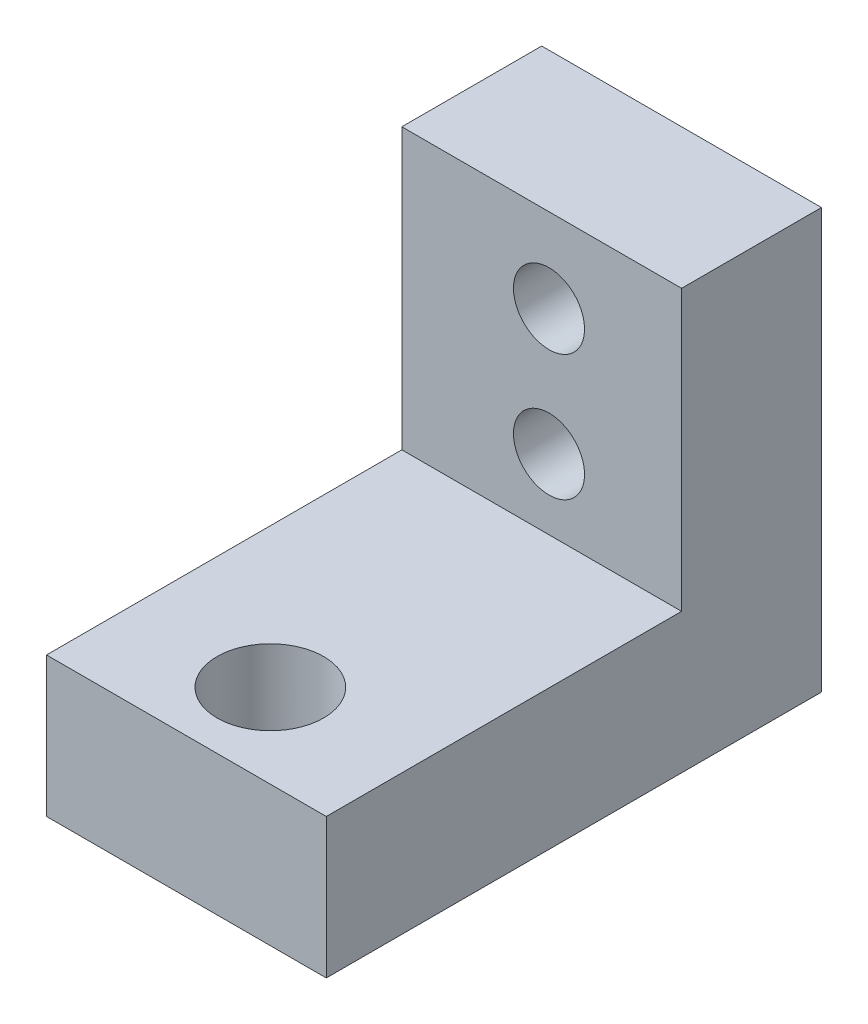
from build123d import *

# Parameters (mm, degrees)
SKETCH1_W           = 20
SKETCH1_H           = 25.4
BOSS_EXTRUDE1_DEPTH = 10
SKETCH2_W           = 20
SKETCH2_H           = 10
BOSS_EXTRUDE2_DEPTH = 30
SKETCH3_R           = 3.81
CUT_EXTRUDE1_DEPTH  = 30
SKETCH4_R           = 2.54
CUT_EXTRUDE2_DEPTH  = 30


with BuildPart() as part:
    # Sketch1 → Boss-Extrude1 (new body)
    with BuildSketch(Plane(origin=(0, 0, 0), x_dir=(1, 0, 0), z_dir=(0, 1, 0))):
        with Locations((10, 12.7)):
            Rectangle(SKETCH1_W, SKETCH1_H)
    extrude(amount=BOSS_EXTRUDE1_DEPTH)

    # Sketch2 → Boss-Extrude2 (add)
    with BuildSketch(Plane(origin=(0, 0, 0), x_dir=(1, 0, 0), z_dir=(0, 1, 0))):
        with Locations((10, 30.4)):
            Rectangle(SKETCH2_W, SKETCH2_H)
    extrude(amount=BOSS_EXTRUDE2_DEPTH)

    # Sketch3 → Cut-Extrude1 (cut)
    with BuildSketch(Plane(origin=(0, 10, 0), x_dir=(1, 0, 0), z_dir=(0, 1, 0))):
        with Locations(Location((10, 6, 0), (0, 0, 270))):
            Circle(SKETCH3_R)
    extrude(amount=-CUT_EXTRUDE1_DEPTH, mode=Mode.SUBTRACT)

    # Sketch4 → Cut-Extrude2 (cut)
    with BuildSketch(Plane(origin=(0, 0, -35.4), x_dir=(-1, 0, 0), z_dir=(0, 0, -1))):
        with Locations((-10.522018302, 24)):
            Circle(SKETCH4_R)
        with Locations((-10.522018302, 15)):
            Circle(SKETCH4_R)
    extrude(amount=-CUT_EXTRUDE2_DEPTH, mode=Mode.SUBTRACT)


solid = part.part
